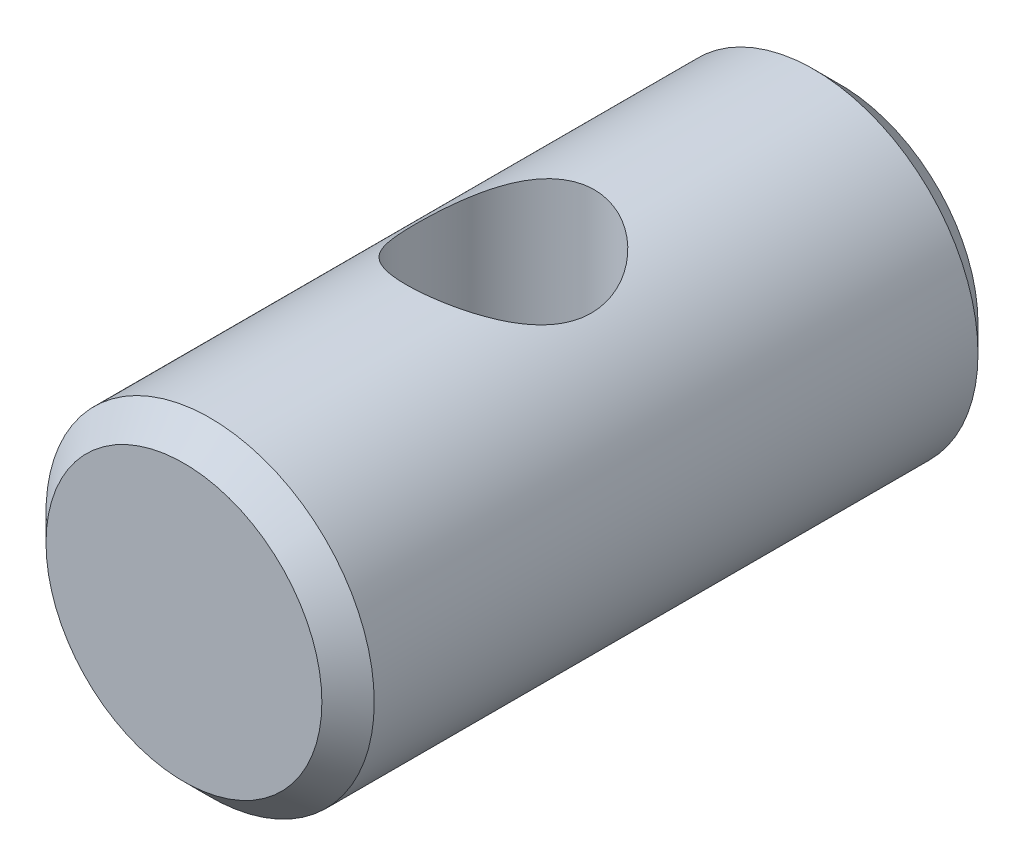
from build123d import *

# Parameters (mm, degrees)
SKETCH1_R               = 4.765
BOSS_EXTRUDE1_DEPTH     = 9.525
CHAMFER1_SIZE           = 0.76
CUT_EXTRUDE1_DEPTH      = 12.667736499
CUT_EXTRUDE1_DEPTH_BACK = 12.667736499
SKETCH2_R               = 2.555


with BuildPart() as part:
    # Sketch1 → Boss-Extrude1 (new, symmetric)
    with BuildSketch(Plane.XY):
        with Locations(Location((0, 0, 0), (0, 0, 180))):
            Circle(SKETCH1_R)
    extrude(amount=BOSS_EXTRUDE1_DEPTH, both=True)

    # Chamfer1
    chamfer1_edges = [part.edges().sort_by_distance(p)[0] for p in [
        (4.765, 0, -9.525),
        (4.765, 0, 9.525),
    ]]
    chamfer(chamfer1_edges, length=CHAMFER1_SIZE)

    # Sketch2 → Cut-Extrude1 (cut, two sides: drawn at the far end of the back side and taken through both)
    with BuildSketch(Plane(origin=(0, 0, 0), x_dir=(1, 0, 0), z_dir=(0, 1, 0)).offset(-CUT_EXTRUDE1_DEPTH_BACK)):
        with Locations(Location((-0.25, 0, 0), (0, 0, 270))):
            Circle(SKETCH2_R)
    extrude(amount=CUT_EXTRUDE1_DEPTH + CUT_EXTRUDE1_DEPTH_BACK, mode=Mode.SUBTRACT)


solid = part.part
